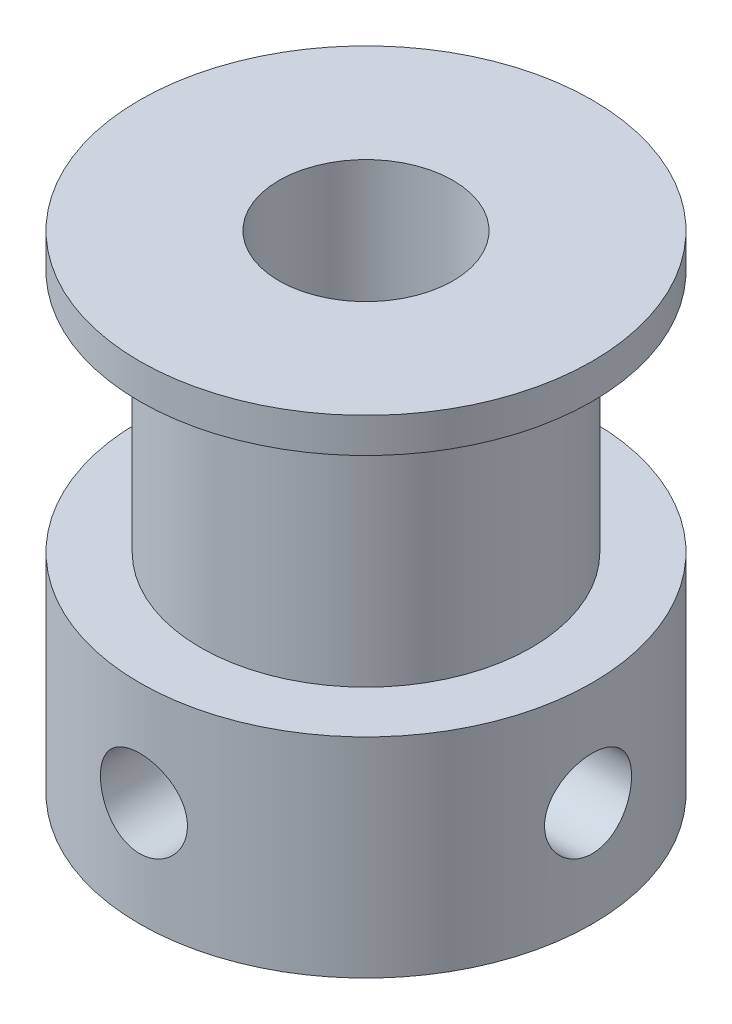
from build123d import *


with BuildPart() as part:
    # 草图1 → 旋转1 (revolve)
    with BuildSketch(Plane.XY, mode=Mode.PRIVATE) as revolve_1_sk:
        Polygon((2.5, 0), (6.5, 0), (6.5, 6), (4.75, 6), (4.75, 13), (6.5, 13), (6.5, 14), (2.5, 14), align=None)
    revolve(revolve_1_sk.sketch.rotate(Axis((0, 0, 0), (0, 1, 0)), 90), axis=Axis((0, 0, 0), (0, 1, 0)))

    # 草图3 → M3 螺纹孔1 (revolve, cut)
    with BuildSketch(Plane(origin=(0, 3, 0), x_dir=(0, 1, 0), z_dir=(1, 0, 0))):
        Polygon((0, 0), (0, 6.5), (1.25, 6.5), (1.25, 0.275), (1.525, 0), align=None)
    revolve(axis=Axis((0, 3, -6.35), (0, 0, 1)), mode=Mode.SUBTRACT)

    # 草图5 → M3 螺纹孔2 (revolve, cut)
    with BuildSketch(Plane.ZX.offset(3)):
        Polygon((0, 0), (0, 6.5), (1.25, 6.5), (1.25, 0.275), (1.525, 0), align=None)
    revolve(axis=Axis((-6.35, 3, 0), (1, 0, 0)), mode=Mode.SUBTRACT)


solid = part.part
